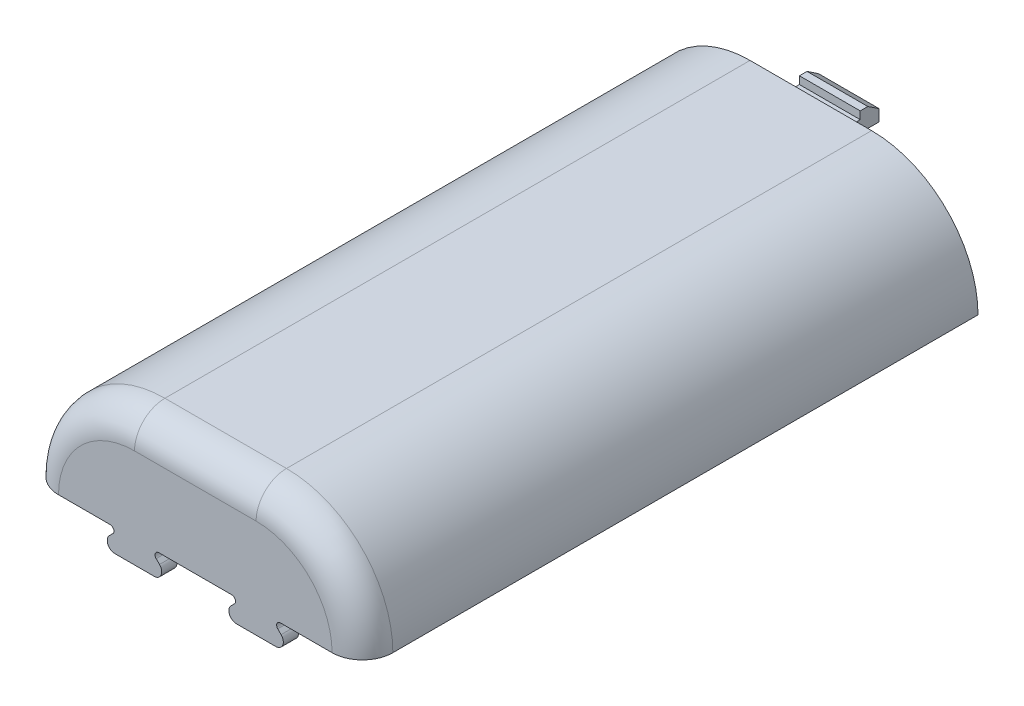
from build123d import *

# Parameters (mm, degrees)
EXTRUDE_1_DEPTH     = 81
SHELL_1_T           = -2
FILLET_1_R          = 4
FILLET_2_R          = 2
CUT_EXTRUDE_START   = -76.5
CUT_EXTRUDE_1_DEPTH = 76.5
EXTRUDE_2_DEPTH     = 4
EXTRUDE_3_DEPTH     = 2
FILLET_3_R          = 1
FILLET_4_R          = 0.5


with BuildPart() as part:
    # 草图1 → 凸台-拉伸1 (new body)
    with BuildSketch(Plane.XY):
        with BuildLine():
            Line((0, 0), (8, 0))
            Line((8, 0), (22, 0))
            ThreePointArc((22, 0), (17.899494937, 9.899494937), (8, 14))
            Line((8, 14), (-8, 14))
            ThreePointArc((-8, 14), (-17.899494937, 9.899494937), (-22, 0))
            Line((-22, 0), (-8, 0))
            Line((-8, 0), (0, 0))
        make_face()
    extrude(amount=-EXTRUDE_1_DEPTH)

    # 抽壳1
    shell_1_openings = [part.faces().sort_by_distance(p)[0] for p in [
        (0, 6.387452756, -81),
        (0, 0, -40.5),
    ]]
    offset(amount=SHELL_1_T, openings=shell_1_openings, kind=Kind.INTERSECTION)

    # 圆角1
    fillet_1_edges = [part.edges().sort_by_distance(p)[0] for p in [
        (-17.899494937, 9.899494937, 0),
        (0, 14, 0),
        (17.899494937, 9.899494937, 0),
    ]]
    fillet(fillet_1_edges, radius=FILLET_1_R)

    # 圆角2
    fillet_2_edges = [part.edges().sort_by_distance(p)[0] for p in [
        (16.485281374, 8.485281374, -2),
        (0, 12, -2),
        (-16.485281374, 8.485281374, -2),
    ]]
    fillet(fillet_2_edges, radius=FILLET_2_R)

    # 草图2 → 切除-拉伸1 (cut)
    with BuildSketch(Plane(origin=(0, 0, -81), x_dir=(-1, 0, 0), z_dir=(0, 0, -1)).offset(CUT_EXTRUDE_START)):
        with BuildLine():
            Line((-20, 0), (-21.05, 0))
            Line((-21.05, 0), (-20.992430448, 1.098492488))
            Line((-20.992430448, 1.098492488), (-19.949615653, 1.098492488))
            ThreePointArc((-19.949615653, 1.098492488), (-19.987397295, 0.549823683), (-20, 0))
        make_face()
        with BuildLine():
            Line((20, 0), (21.05, 0))
            Line((21.05, 0), (20.992430448, 1.098492488))
            Line((20.992430448, 1.098492488), (19.949615653, 1.098492488))
            ThreePointArc((19.949615653, 1.098492488), (19.987397295, 0.549823683), (20, 0))
        make_face()
    extrude(amount=CUT_EXTRUDE_1_DEPTH, mode=Mode.SUBTRACT)

    # 草图3 → 凸台-拉伸2 (add, symmetric)
    with BuildSketch(Plane(origin=(0, 0, 0), x_dir=(0, 0, -1), z_dir=(1, 0, 0))):
        Polygon((81, 12), (81, 13), (78, 13), (78, 10.5), (81, 10.5), (86, 10.5), (86, 12), (84.5, 13), (83.5, 13), (83.5, 12), align=None)
    extrude(amount=EXTRUDE_2_DEPTH, both=True)

    # 草图4 → 凸台-拉伸3 (add)
    with BuildSketch(Plane.XY):
        Polygon((-8, 0), (-6, 0), (-3, -3), (-6, -3), (-10, -3), (-13, -3), (-10, 0), align=None)
        Polygon((3, -3), (6, 0), (8, 0), (10, 0), (13, -3), (10, -3), (6, -3), align=None)
    extrude(amount=-EXTRUDE_3_DEPTH)

    # 圆角3
    fillet_3_edges = [part.edges().sort_by_distance(p)[0] for p in [
        (-3, -3, -1),
        (-13, -3, -1),
        (3, -3, -1),
        (13, -3, -1),
    ]]
    fillet(fillet_3_edges, radius=FILLET_3_R)

    # 圆角4
    fillet_4_edges = [part.edges().sort_by_distance(p)[0] for p in [
        (-10, 0, -1),
        (-6, 0, -1),
        (6, 0, -1),
        (10, 0, -1),
    ]]
    fillet(fillet_4_edges, radius=FILLET_4_R)


solid = part.part
